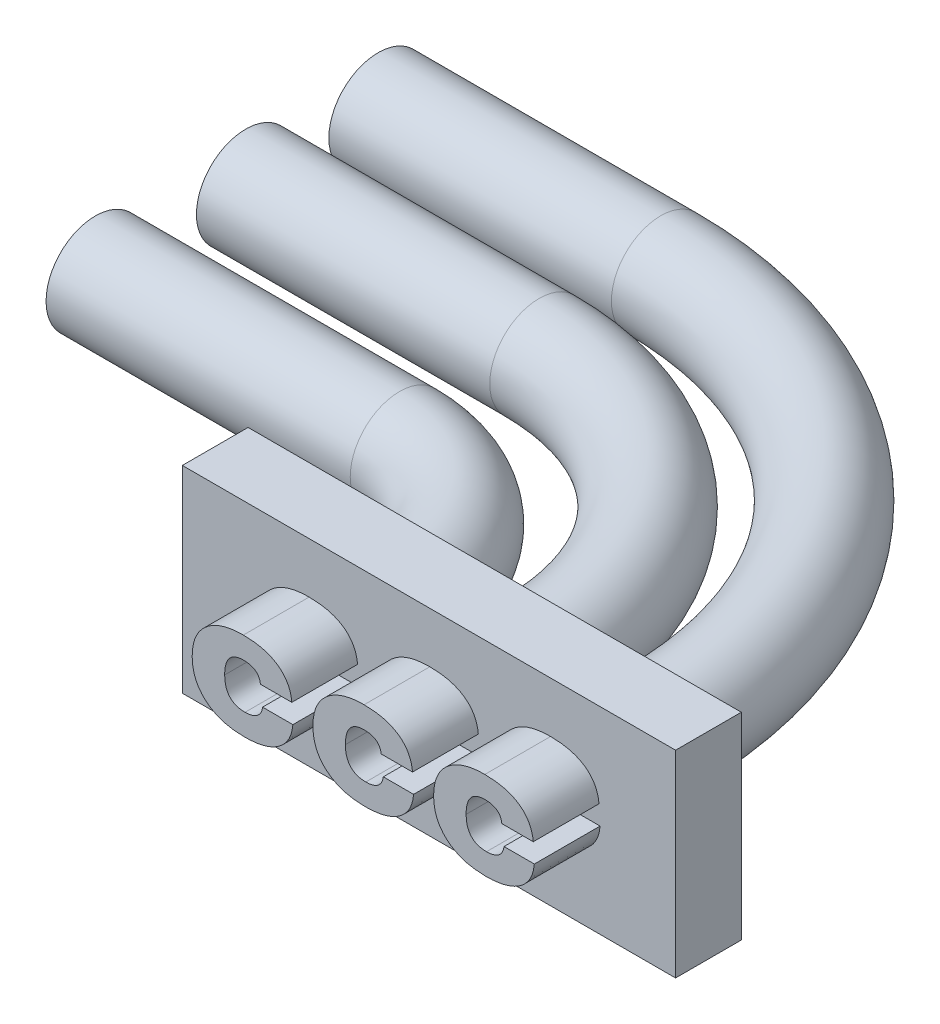
from build123d import *

# Parameters (mm, degrees)
SKETCH1_W           = 15
SKETCH1_H           = 6
BOSS_EXTRUDE1_DEPTH = 2
BOSS_EXTRUDE2_DEPTH = 2
SKETCH3_W           = 1.5
SKETCH3_H           = 4
BOSS_EXTRUDE3_DEPTH = 2
SKETCH12_W          = 14.1
SKETCH12_H          = 5
CUT_EXTRUDE1_DEPTH  = 21.804086224
SKETCH8_R           = 1.5
SKETCH7_R           = 1.5
SKETCH6_R           = 1.5


with BuildPart() as part:
    # Sketch1 → Boss-Extrude1 (new body)
    with BuildSketch(Plane.XY):
        Rectangle(SKETCH1_W, SKETCH1_H)
    extrude(amount=BOSS_EXTRUDE1_DEPTH)

    # Sketch2 → Boss-Extrude2 (add)
    with BuildSketch(Plane.XY.offset(2)):
        with BuildLine():
            Line((-3.060082731, -0.145888163), (-2.138122178, -0.145888163))
            add(Edge.make_bspline(
                [(-2.138122178, -0.145888163), (-2.142670856, -0.186817863), (-2.151591905, -0.267090827), (-2.177769169, -0.383345409), (-2.21581097, -0.492138159), (-2.263624462, -0.594453887), (-2.323094811, -0.689286262), (-2.393268208, -0.777226894), (-2.474496925, -0.857513187), (-2.56593251, -0.930702134), (-2.666921735, -0.996049335), (-2.776982197, -1.052595512), (-2.895454873, -1.100578301), (-3.022533127, -1.139544776), (-3.158112272, -1.169766838), (-3.302219404, -1.190920315), (-3.454592079, -1.204838445), (-3.559102892, -1.206109201), (-3.612641679, -1.206760184)],
                knots=[0, 0, 0, 0, 0.976829506, 1.915797078, 2.820653329, 3.707285315, 4.590388637, 5.470720937, 6.371504049, 7.295059075, 8.245589783, 9.221265507, 10.22720936, 11.275107911, 12.372107559, 13.52041678, 14.729759393, 16, 16, 16, 16], degree=3))
            add(Edge.make_bspline(
                [(-3.612641679, -1.206760184), (-3.672703037, -1.205681875), (-3.78980194, -1.203579545), (-3.960409691, -1.187028741), (-4.121131552, -1.159524222), (-4.272151379, -1.120467746), (-4.41338954, -1.070117311), (-4.545018014, -1.008999239), (-4.666052683, -0.9357143), (-4.759428604, -0.866298777), (-4.827861299, -0.80519677), (-4.876126049, -0.757629416), (-4.920907868, -0.707879294), (-4.961799812, -0.655502017), (-5.001017469, -0.602324328), (-5.03520084, -0.545835782), (-5.066531819, -0.487757573), (-5.095227297, -0.427867871), (-5.119706435, -0.365492075), (-5.141169611, -0.301230601), (-5.160246588, -0.235142926), (-5.173972983, -0.16652574), (-5.186283094, -0.096102513), (-5.194098935, -0.023574116), (-5.199662301, 0.050901618), (-5.200117214, 0.101226019), (-5.200348302, 0.126789902)],
                knots=[0, 0, 0, 0, 1.844349952, 3.595845402, 5.258382034, 6.847576437, 8.380255859, 9.857610627, 11.296535068, 12.718617156, 13.423703043, 14.112710587, 14.79899505, 15.477617194, 16.152961149, 16.826845299, 17.503194887, 18.179359879, 18.864977055, 19.559518563, 20.259847437, 20.975709944, 21.707382985, 22.454791923, 23.215062313, 24, 24, 24, 24], degree=3))
            add(Edge.make_bspline(
                [(-5.200348302, 0.126789902), (-5.20010237, 0.152180931), (-5.199614969, 0.202502272), (-5.194209089, 0.276824794), (-5.186092921, 0.349110093), (-5.174639319, 0.419303704), (-5.16060764, 0.487612395), (-5.142177766, 0.553751295), (-5.121526835, 0.618038985), (-5.096362936, 0.679989613), (-5.06892589, 0.74011142), (-5.037645758, 0.797974151), (-5.003916141, 0.854253903), (-4.966122932, 0.908133198), (-4.925686325, 0.960385835), (-4.880950125, 1.009688803), (-4.833769122, 1.057627908), (-4.766340776, 1.11879755), (-4.675008641, 1.189066666), (-4.555365546, 1.261581715), (-4.426723513, 1.323905616), (-4.288155058, 1.373282632), (-4.140527998, 1.412584115), (-3.983451282, 1.440688501), (-3.816730635, 1.457118665), (-3.702542629, 1.459248516), (-3.644025381, 1.460339989)],
                knots=[0, 0, 0, 0, 0.788949478, 1.563583616, 2.314590912, 3.048845008, 3.773225905, 4.480463959, 5.181590848, 5.870415235, 6.557195353, 7.234374924, 7.913502193, 8.595071886, 9.278472863, 9.965397725, 10.662604099, 11.368153272, 12.793402362, 14.235777976, 15.708930775, 17.227954371, 18.799982801, 20.451742852, 22.181645754, 24, 24, 24, 24], degree=3))
            add(Edge.make_bspline(
                [(-3.644025381, 1.460339989), (-3.590145407, 1.459654041), (-3.484967955, 1.458315025), (-3.331779518, 1.444898309), (-3.187282445, 1.425014513), (-3.051742807, 1.395613017), (-2.925065251, 1.357757509), (-2.807100237, 1.311399315), (-2.697988088, 1.256802381), (-2.597921972, 1.19407992), (-2.507288128, 1.123496152), (-2.42730916, 1.045048752), (-2.357479614, 0.959432927), (-2.298872924, 0.866301097), (-2.249803372, 0.766268305), (-2.212782576, 0.658660702), (-2.184664141, 0.544165897), (-2.175657871, 0.464783504), (-2.17104934, 0.42416334)],
                knots=[0, 0, 0, 0, 1.289638031, 2.517463008, 3.678757242, 4.779638757, 5.834372698, 6.840786757, 7.810284887, 8.751219913, 9.663723068, 10.555058948, 11.427779484, 12.302574037, 13.183982208, 14.089056298, 15.022165429, 16, 16, 16, 16], degree=3))
            Line((-2.17104934, 0.42416334), (-3.125937056, 0.42416334))
            add(Edge.make_bspline(
                [(-3.125937056, 0.42416334), (-3.127887549, 0.43930189), (-3.131710048, 0.468969842), (-3.142040136, 0.511730167), (-3.155998966, 0.551467781), (-3.173017188, 0.588472211), (-3.193630284, 0.622418347), (-3.217560825, 0.653683148), (-3.244880123, 0.682137249), (-3.275932903, 0.70732909), (-3.310313405, 0.72961548), (-3.347848304, 0.749134153), (-3.388701646, 0.76557697), (-3.432765481, 0.77899212), (-3.480105092, 0.789183756), (-3.530681368, 0.796119849), (-3.584421185, 0.801027394), (-3.621376024, 0.801535064), (-3.640423973, 0.801796736)],
                knots=[0, 0, 0, 0, 1.02792653, 2.014490992, 2.957386111, 3.862121815, 4.753924626, 5.627574869, 6.51019678, 7.405362218, 8.315615775, 9.266619089, 10.251558014, 11.278704828, 12.366648388, 13.51059177, 14.716862994, 16, 16, 16, 16], degree=3))
            add(Edge.make_bspline(
                [(-3.640423973, 0.801796736), (-3.66359615, 0.801322385), (-3.708533487, 0.800402487), (-3.773695909, 0.792761593), (-3.834173486, 0.779391176), (-3.890254475, 0.760839723), (-3.942034126, 0.737056913), (-3.989624331, 0.708404931), (-4.032399456, 0.67383737), (-4.070628025, 0.634091204), (-4.104105801, 0.588767942), (-4.133882485, 0.538692432), (-4.157647598, 0.482571167), (-4.177808251, 0.421494548), (-4.193663959, 0.355071069), (-4.204784234, 0.283334137), (-4.211575895, 0.206324597), (-4.212207123, 0.153214936), (-4.212533423, 0.125760928)],
                knots=[0, 0, 0, 0, 1.096253294, 2.125941888, 3.09853747, 4.02234602, 4.9155674, 5.789561441, 6.643741359, 7.510358195, 8.391630331, 9.304611926, 10.260406741, 11.268901007, 12.345516153, 13.487518248, 14.70122137, 16, 16, 16, 16], degree=3))
            add(Edge.make_bspline(
                [(-4.212533423, 0.125760928), (-4.212023732, 0.098820004), (-4.211034896, 0.046552836), (-4.20387538, -0.029304282), (-4.191745473, -0.100083864), (-4.174082766, -0.165772241), (-4.152269564, -0.226559049), (-4.125261299, -0.282308092), (-4.09338658, -0.333065066), (-4.056054059, -0.378504224), (-4.014296197, -0.419012114), (-3.96742428, -0.453622328), (-3.91626571, -0.483220184), (-3.860158566, -0.506780196), (-3.799647084, -0.525328362), (-3.73468148, -0.538434558), (-3.665177261, -0.547030055), (-3.617299342, -0.547812765), (-3.592576689, -0.548216932)],
                knots=[0, 0, 0, 0, 1.234472244, 2.394957414, 3.488022233, 4.52125041, 5.508253929, 6.443198368, 7.354559284, 8.248126489, 9.131859273, 10.013633023, 10.911406571, 11.833948595, 12.795981492, 13.807064445, 14.867636965, 16, 16, 16, 16], degree=3))
            add(Edge.make_bspline(
                [(-3.592576689, -0.548216932), (-3.573523043, -0.548008488), (-3.53637073, -0.547602048), (-3.482331036, -0.541902553), (-3.431051927, -0.534930223), (-3.383278569, -0.522562968), (-3.338007293, -0.508440572), (-3.295951089, -0.490511601), (-3.256998066, -0.469088819), (-3.220875063, -0.445176153), (-3.188314834, -0.417525473), (-3.158686185, -0.387396389), (-3.133666577, -0.353410241), (-3.111160748, -0.317572759), (-3.093383205, -0.278451413), (-3.078216775, -0.23709906), (-3.066824033, -0.192623437), (-3.06236613, -0.161718235), (-3.060082731, -0.145888163)],
                knots=[0, 0, 0, 0, 1.233312579, 2.404810797, 3.516940584, 4.580999436, 5.596108869, 6.586365755, 7.535726907, 8.472201243, 9.38661427, 10.29778373, 11.201885539, 12.11434029, 13.033597211, 13.978725792, 14.964675429, 16, 16, 16, 16], degree=3))
        make_face()
        with BuildLine():
            Line((0.611295902, -0.145888163), (1.533256455, -0.145888163))
            add(Edge.make_bspline(
                [(1.533256455, -0.145888163), (1.528707777, -0.186817863), (1.519786728, -0.267090827), (1.493609464, -0.383345409), (1.455567663, -0.492138159), (1.407754171, -0.594453887), (1.348283822, -0.689286262), (1.278110424, -0.777226894), (1.196881708, -0.857513187), (1.105446123, -0.930702134), (1.004456897, -0.996049335), (0.894396436, -1.052595512), (0.775923759, -1.100578301), (0.648845506, -1.139544776), (0.51326636, -1.169766838), (0.369159229, -1.190920315), (0.216786554, -1.204838445), (0.112275741, -1.206109201), (0.058736954, -1.206760184)],
                knots=[0, 0, 0, 0, 0.976829506, 1.915797078, 2.820653329, 3.707285315, 4.590388637, 5.470720937, 6.371504049, 7.295059075, 8.245589783, 9.221265507, 10.22720936, 11.275107911, 12.372107559, 13.52041678, 14.729759393, 16, 16, 16, 16], degree=3))
            add(Edge.make_bspline(
                [(0.058736954, -1.206760184), (-0.001324404, -1.205681875), (-0.118423307, -1.203579545), (-0.289031058, -1.187028741), (-0.449752919, -1.159524222), (-0.600772746, -1.120467746), (-0.742010907, -1.070117311), (-0.873639381, -1.008999239), (-0.99467405, -0.9357143), (-1.088049971, -0.866298777), (-1.156482666, -0.80519677), (-1.204747416, -0.757629416), (-1.249529235, -0.707879294), (-1.290421179, -0.655502017), (-1.329638836, -0.602324328), (-1.363822207, -0.545835782), (-1.395153186, -0.487757573), (-1.423848664, -0.427867871), (-1.448327802, -0.365492075), (-1.469790978, -0.301230601), (-1.488867955, -0.235142926), (-1.50259435, -0.16652574), (-1.514904461, -0.096102513), (-1.522720303, -0.023574116), (-1.528283668, 0.050901618), (-1.528738581, 0.101226019), (-1.528969669, 0.126789902)],
                knots=[0, 0, 0, 0, 1.844349952, 3.595845402, 5.258382034, 6.847576437, 8.380255859, 9.857610627, 11.296535068, 12.718617156, 13.423703043, 14.112710587, 14.79899505, 15.477617194, 16.152961149, 16.826845299, 17.503194887, 18.179359879, 18.864977055, 19.559518563, 20.259847437, 20.975709944, 21.707382985, 22.454791923, 23.215062313, 24, 24, 24, 24], degree=3))
            add(Edge.make_bspline(
                [(-1.528969669, 0.126789902), (-1.528723737, 0.152180931), (-1.528236336, 0.202502272), (-1.522830456, 0.276824794), (-1.514714289, 0.349110093), (-1.503260687, 0.419303704), (-1.489229007, 0.487612395), (-1.470799133, 0.553751295), (-1.450148202, 0.618038985), (-1.424984304, 0.679989613), (-1.397547257, 0.74011142), (-1.366267126, 0.797974151), (-1.332537508, 0.854253903), (-1.294744299, 0.908133198), (-1.254307692, 0.960385835), (-1.209571492, 1.009688803), (-1.162390489, 1.057627908), (-1.094962143, 1.11879755), (-1.003630008, 1.189066666), (-0.883986913, 1.261581715), (-0.75534488, 1.323905616), (-0.616776425, 1.373282632), (-0.469149365, 1.412584115), (-0.312072649, 1.440688501), (-0.145352002, 1.457118665), (-0.031163997, 1.459248516), (0.027353252, 1.460339989)],
                knots=[0, 0, 0, 0, 0.788949478, 1.563583616, 2.314590912, 3.048845008, 3.773225905, 4.480463959, 5.181590848, 5.870415235, 6.557195353, 7.234374924, 7.913502193, 8.595071886, 9.278472863, 9.965397725, 10.662604099, 11.368153272, 12.793402362, 14.235777976, 15.708930775, 17.227954371, 18.799982801, 20.451742852, 22.181645754, 24, 24, 24, 24], degree=3))
            add(Edge.make_bspline(
                [(0.027353252, 1.460339989), (0.081233226, 1.459654041), (0.186410678, 1.458315025), (0.339599115, 1.444898309), (0.484096188, 1.425014513), (0.619635826, 1.395613017), (0.746313382, 1.357757509), (0.864278396, 1.311399315), (0.973390545, 1.256802381), (1.073456661, 1.19407992), (1.164090505, 1.123496152), (1.244069473, 1.045048752), (1.313899019, 0.959432927), (1.372505709, 0.866301097), (1.421575261, 0.766268305), (1.458596057, 0.658660702), (1.486714492, 0.544165897), (1.495720762, 0.464783504), (1.500329293, 0.42416334)],
                knots=[0, 0, 0, 0, 1.289638031, 2.517463008, 3.678757242, 4.779638757, 5.834372698, 6.840786757, 7.810284887, 8.751219913, 9.663723068, 10.555058948, 11.427779484, 12.302574037, 13.183982208, 14.089056298, 15.022165429, 16, 16, 16, 16], degree=3))
            Line((1.500329293, 0.42416334), (0.545441576, 0.42416334))
            add(Edge.make_bspline(
                [(0.545441576, 0.42416334), (0.543491084, 0.43930189), (0.539668585, 0.468969842), (0.529338497, 0.511730167), (0.515379666, 0.551467781), (0.498361445, 0.588472211), (0.477748349, 0.622418347), (0.453817808, 0.653683148), (0.42649851, 0.682137249), (0.39544573, 0.70732909), (0.361065228, 0.72961548), (0.323530328, 0.749134153), (0.282676987, 0.76557697), (0.238613151, 0.77899212), (0.191273541, 0.789183756), (0.140697265, 0.796119849), (0.086957447, 0.801027394), (0.050002609, 0.801535064), (0.03095466, 0.801796736)],
                knots=[0, 0, 0, 0, 1.02792653, 2.014490992, 2.957386111, 3.862121815, 4.753924626, 5.627574869, 6.51019678, 7.405362218, 8.315615775, 9.266619089, 10.251558014, 11.278704828, 12.366648388, 13.51059177, 14.716862994, 16, 16, 16, 16], degree=3))
            add(Edge.make_bspline(
                [(0.03095466, 0.801796736), (0.007782483, 0.801322385), (-0.037154854, 0.800402487), (-0.102317276, 0.792761593), (-0.162794853, 0.779391176), (-0.218875842, 0.760839723), (-0.270655493, 0.737056913), (-0.318245698, 0.708404931), (-0.361020823, 0.67383737), (-0.399249392, 0.634091204), (-0.432727168, 0.588767942), (-0.462503853, 0.538692432), (-0.486268965, 0.482571167), (-0.506429618, 0.421494548), (-0.522285326, 0.355071069), (-0.533405601, 0.283334137), (-0.540197262, 0.206324597), (-0.54082849, 0.153214936), (-0.54115479, 0.125760928)],
                knots=[0, 0, 0, 0, 1.096253294, 2.125941888, 3.09853747, 4.02234602, 4.9155674, 5.789561441, 6.643741359, 7.510358195, 8.391630331, 9.304611926, 10.260406741, 11.268901007, 12.345516153, 13.487518248, 14.70122137, 16, 16, 16, 16], degree=3))
            add(Edge.make_bspline(
                [(-0.54115479, 0.125760928), (-0.540645099, 0.098820004), (-0.539656263, 0.046552836), (-0.532496747, -0.029304282), (-0.52036684, -0.100083864), (-0.502704133, -0.165772241), (-0.480890931, -0.226559049), (-0.453882667, -0.282308092), (-0.422007947, -0.333065066), (-0.384675426, -0.378504224), (-0.342917564, -0.419012114), (-0.296045647, -0.453622328), (-0.244887077, -0.483220184), (-0.188779933, -0.506780196), (-0.128268451, -0.525328362), (-0.063302847, -0.538434558), (0.006201372, -0.547030055), (0.054079291, -0.547812765), (0.078801944, -0.548216932)],
                knots=[0, 0, 0, 0, 1.234472244, 2.394957414, 3.488022233, 4.52125041, 5.508253929, 6.443198368, 7.354559284, 8.248126489, 9.131859273, 10.013633023, 10.911406571, 11.833948595, 12.795981492, 13.807064445, 14.867636965, 16, 16, 16, 16], degree=3))
            add(Edge.make_bspline(
                [(0.078801944, -0.548216932), (0.09785559, -0.548008488), (0.135007902, -0.547602048), (0.189047596, -0.541902553), (0.240326706, -0.534930223), (0.288100063, -0.522562968), (0.33337134, -0.508440572), (0.375427544, -0.490511601), (0.414380567, -0.469088819), (0.45050357, -0.445176153), (0.483063798, -0.417525473), (0.512692448, -0.387396389), (0.537712056, -0.353410241), (0.560217885, -0.317572759), (0.577995428, -0.278451413), (0.593161858, -0.23709906), (0.6045546, -0.192623437), (0.609012502, -0.161718235), (0.611295902, -0.145888163)],
                knots=[0, 0, 0, 0, 1.233312579, 2.404810797, 3.516940584, 4.580999436, 5.596108869, 6.586365755, 7.535726907, 8.472201243, 9.38661427, 10.29778373, 11.201885539, 12.11434029, 13.033597211, 13.978725792, 14.964675429, 16, 16, 16, 16], degree=3))
        make_face()
        with BuildLine():
            Line((4.282674535, -0.145888163), (5.204635088, -0.145888163))
            add(Edge.make_bspline(
                [(5.204635088, -0.145888163), (5.20008641, -0.186817863), (5.191165361, -0.267090827), (5.164988097, -0.383345409), (5.126946296, -0.492138159), (5.079132804, -0.594453887), (5.019662455, -0.689286262), (4.949489057, -0.777226894), (4.868260341, -0.857513187), (4.776824756, -0.930702134), (4.67583553, -0.996049335), (4.565775069, -1.052595512), (4.447302392, -1.100578301), (4.320224139, -1.139544776), (4.184644993, -1.169766838), (4.040537862, -1.190920315), (3.888165187, -1.204838445), (3.783654374, -1.206109201), (3.730115587, -1.206760184)],
                knots=[0, 0, 0, 0, 0.976829506, 1.915797078, 2.820653329, 3.707285315, 4.590388637, 5.470720937, 6.371504049, 7.295059075, 8.245589783, 9.221265507, 10.22720936, 11.275107911, 12.372107559, 13.52041678, 14.729759393, 16, 16, 16, 16], degree=3))
            add(Edge.make_bspline(
                [(3.730115587, -1.206760184), (3.670054229, -1.205681875), (3.552955326, -1.203579545), (3.382347575, -1.187028741), (3.221625714, -1.159524222), (3.070605887, -1.120467746), (2.929367726, -1.070117311), (2.797739252, -1.008999239), (2.676704583, -0.9357143), (2.583328662, -0.866298777), (2.514895967, -0.80519677), (2.466631217, -0.757629416), (2.421849398, -0.707879294), (2.380957454, -0.655502017), (2.341739797, -0.602324328), (2.307556425, -0.545835782), (2.276225447, -0.487757573), (2.247529968, -0.427867871), (2.223050831, -0.365492075), (2.201587655, -0.301230601), (2.182510678, -0.235142926), (2.168784283, -0.16652574), (2.156474172, -0.096102513), (2.14865833, -0.023574116), (2.143094965, 0.050901618), (2.142640052, 0.101226019), (2.142408964, 0.126789902)],
                knots=[0, 0, 0, 0, 1.844349952, 3.595845402, 5.258382034, 6.847576437, 8.380255859, 9.857610627, 11.296535068, 12.718617156, 13.423703043, 14.112710587, 14.79899505, 15.477617194, 16.152961149, 16.826845299, 17.503194887, 18.179359879, 18.864977055, 19.559518563, 20.259847437, 20.975709944, 21.707382985, 22.454791923, 23.215062313, 24, 24, 24, 24], degree=3))
            add(Edge.make_bspline(
                [(2.142408964, 0.126789902), (2.142654896, 0.152180931), (2.143142297, 0.202502272), (2.148548177, 0.276824794), (2.156664344, 0.349110093), (2.168117946, 0.419303704), (2.182149625, 0.487612395), (2.2005795, 0.553751295), (2.221230431, 0.618038985), (2.246394329, 0.679989613), (2.273831375, 0.74011142), (2.305111507, 0.797974151), (2.338841125, 0.854253903), (2.376634334, 0.908133198), (2.417070941, 0.960385835), (2.461807141, 1.009688803), (2.508988144, 1.057627908), (2.57641649, 1.11879755), (2.667748625, 1.189066666), (2.78739172, 1.261581715), (2.916033753, 1.323905616), (3.054602208, 1.373282632), (3.202229268, 1.412584115), (3.359305984, 1.440688501), (3.52602663, 1.457118665), (3.640214636, 1.459248516), (3.698731885, 1.460339989)],
                knots=[0, 0, 0, 0, 0.788949478, 1.563583616, 2.314590912, 3.048845008, 3.773225905, 4.480463959, 5.181590848, 5.870415235, 6.557195353, 7.234374924, 7.913502193, 8.595071886, 9.278472863, 9.965397725, 10.662604099, 11.368153272, 12.793402362, 14.235777976, 15.708930775, 17.227954371, 18.799982801, 20.451742852, 22.181645754, 24, 24, 24, 24], degree=3))
            add(Edge.make_bspline(
                [(3.698731885, 1.460339989), (3.752611859, 1.459654041), (3.857789311, 1.458315025), (4.010977748, 1.444898309), (4.155474821, 1.425014513), (4.291014459, 1.395613017), (4.417692015, 1.357757509), (4.535657029, 1.311399315), (4.644769178, 1.256802381), (4.744835294, 1.19407992), (4.835469138, 1.123496152), (4.915448106, 1.045048752), (4.985277651, 0.959432927), (5.043884342, 0.866301097), (5.092953894, 0.766268305), (5.12997469, 0.658660702), (5.158093125, 0.544165897), (5.167099395, 0.464783504), (5.171707925, 0.42416334)],
                knots=[0, 0, 0, 0, 1.289638031, 2.517463008, 3.678757242, 4.779638757, 5.834372698, 6.840786757, 7.810284887, 8.751219913, 9.663723068, 10.555058948, 11.427779484, 12.302574037, 13.183982208, 14.089056298, 15.022165429, 16, 16, 16, 16], degree=3))
            Line((5.171707925, 0.42416334), (4.216820209, 0.42416334))
            add(Edge.make_bspline(
                [(4.216820209, 0.42416334), (4.214869717, 0.43930189), (4.211047218, 0.468969842), (4.20071713, 0.511730167), (4.186758299, 0.551467781), (4.169740078, 0.588472211), (4.149126982, 0.622418347), (4.125196441, 0.653683148), (4.097877142, 0.682137249), (4.066824363, 0.70732909), (4.032443861, 0.72961548), (3.994908961, 0.749134153), (3.95405562, 0.76557697), (3.909991784, 0.77899212), (3.862652174, 0.789183756), (3.812075898, 0.796119849), (3.75833608, 0.801027394), (3.721381242, 0.801535064), (3.702333293, 0.801796736)],
                knots=[0, 0, 0, 0, 1.02792653, 2.014490992, 2.957386111, 3.862121815, 4.753924626, 5.627574869, 6.51019678, 7.405362218, 8.315615775, 9.266619089, 10.251558014, 11.278704828, 12.366648388, 13.51059177, 14.716862994, 16, 16, 16, 16], degree=3))
            add(Edge.make_bspline(
                [(3.702333293, 0.801796736), (3.679161115, 0.801322385), (3.634223779, 0.800402487), (3.569061357, 0.792761593), (3.50858378, 0.779391176), (3.452502791, 0.760839723), (3.400723139, 0.737056913), (3.353132935, 0.708404931), (3.31035781, 0.67383737), (3.272129241, 0.634091204), (3.238651465, 0.588767942), (3.20887478, 0.538692432), (3.185109668, 0.482571167), (3.164949015, 0.421494548), (3.149093307, 0.355071069), (3.137973032, 0.283334137), (3.13118137, 0.206324597), (3.130550143, 0.153214936), (3.130223843, 0.125760928)],
                knots=[0, 0, 0, 0, 1.096253294, 2.125941888, 3.09853747, 4.02234602, 4.9155674, 5.789561441, 6.643741359, 7.510358195, 8.391630331, 9.304611926, 10.260406741, 11.268901007, 12.345516153, 13.487518248, 14.70122137, 16, 16, 16, 16], degree=3))
            add(Edge.make_bspline(
                [(3.130223843, 0.125760928), (3.130733534, 0.098820004), (3.131722369, 0.046552836), (3.138881885, -0.029304282), (3.151011793, -0.100083864), (3.1686745, -0.165772241), (3.190487702, -0.226559049), (3.217495966, -0.282308092), (3.249370686, -0.333065066), (3.286703207, -0.378504224), (3.328461069, -0.419012114), (3.375332985, -0.453622328), (3.426491556, -0.483220184), (3.4825987, -0.506780196), (3.543110182, -0.525328362), (3.608075786, -0.538434558), (3.677580005, -0.547030055), (3.725457923, -0.547812765), (3.750180576, -0.548216932)],
                knots=[0, 0, 0, 0, 1.234472244, 2.394957414, 3.488022233, 4.52125041, 5.508253929, 6.443198368, 7.354559284, 8.248126489, 9.131859273, 10.013633023, 10.911406571, 11.833948595, 12.795981492, 13.807064445, 14.867636965, 16, 16, 16, 16], degree=3))
            add(Edge.make_bspline(
                [(3.750180576, -0.548216932), (3.769234223, -0.548008488), (3.806386535, -0.547602048), (3.860426229, -0.541902553), (3.911705338, -0.534930223), (3.959478696, -0.522562968), (4.004749973, -0.508440572), (4.046806177, -0.490511601), (4.0857592, -0.469088819), (4.121882203, -0.445176153), (4.154442431, -0.417525473), (4.184071081, -0.387396389), (4.209090689, -0.353410241), (4.231596518, -0.317572759), (4.249374061, -0.278451413), (4.264540491, -0.23709906), (4.275933233, -0.192623437), (4.280391135, -0.161718235), (4.282674535, -0.145888163)],
                knots=[0, 0, 0, 0, 1.233312579, 2.404810797, 3.516940584, 4.580999436, 5.596108869, 6.586365755, 7.535726907, 8.472201243, 9.38661427, 10.29778373, 11.201885539, 12.11434029, 13.033597211, 13.978725792, 14.964675429, 16, 16, 16, 16], degree=3))
        make_face()
    extrude(amount=BOSS_EXTRUDE2_DEPTH)

    # Sketch3 → Boss-Extrude3 (add, symmetric)
    with BuildSketch(Plane(origin=(0, 0, 0), x_dir=(1, 0, 0), z_dir=(0, 1, 0))):
        Polygon((2.948731885, 0), (4.448731885, 0), (4.448731885, 14.1), (-2.422646748, 14.1), (-2.422646748, 12.6), (2.948731885, 12.6), align=None)
        with Locations((-3.644025381, 2)):
            Rectangle(SKETCH3_W, SKETCH3_H)
        Polygon((-0.722646748, 0), (0.777353252, 0), (0.777353252, 10.1), (-2.422646748, 10.1), (-2.422646748, 8.6), (-0.722646748, 8.6), align=None)
    extrude(amount=BOSS_EXTRUDE3_DEPTH, both=True)

    # Sketch12 → Cut-Extrude1 (cut, through all)
    with BuildSketch(Plane(origin=(7.5, 0, 0), x_dir=(0, 0, -1), z_dir=(1, 0, 0))):
        with Locations((7.05, -0.5)):
            Rectangle(SKETCH12_W, SKETCH12_H)
    extrude(amount=-CUT_EXTRUDE1_DEPTH, mode=Mode.SUBTRACT)

    # Sweep1: sweep along a path in Sketch9
    with BuildLine(Plane(origin=(0, 0, 0), x_dir=(1, 0, 0), z_dir=(0, 1, 0))) as sweep1_path:
        Line((-3.644025381, 0), (-3.644025381, 0.75))
        ThreePointArc((-3.644025381, 0.75), (-4.815598256, 3.578427125), (-7.644025381, 4.75))
        Line((-7.644025381, 4.75), (-16.894025381, 4.75))
    # Sketch8 → Sweep1 (sweep)
    with BuildSketch(Plane(origin=(0, 0, 0), x_dir=(-1, 0, 0), z_dir=(0, 0, -1))):
        with Locations((3.644025381, 0)):
            Circle(SKETCH8_R)
    sweep(path=sweep1_path.line)

    # Sweep2: sweep along a path in Sketch10
    with BuildLine(Plane(origin=(0, 0, 0), x_dir=(1, 0, 0), z_dir=(0, 1, 0))) as sweep2_path:
        Line((0.027353252, 0), (0.027353252, 1.35))
        ThreePointArc((0.027353252, 1.35), (-2.315792499, 7.006854249), (-7.972646748, 9.35))
        Line((-7.972646748, 9.35), (-16.894025748, 9.35))
    # Sketch7 → Sweep2 (sweep)
    with BuildSketch(Plane(origin=(0, 0, 0), x_dir=(-1, 0, 0), z_dir=(0, 0, -1))):
        Circle(SKETCH7_R)
    sweep(path=sweep2_path.line)

    # Sweep3: sweep along a path in Sketch11
    with BuildLine(Plane(origin=(0, 0, 0), x_dir=(1, 0, 0), z_dir=(0, 1, 0))) as sweep3_path:
        Line((3.698731885, 0), (3.698731885, 1.35))
        ThreePointArc((3.698731885, 1.35), (0.184013259, 9.835281374), (-8.301268115, 13.35))
        Line((-8.301268115, 13.35), (-16.894025115, 13.35))
    # Sketch6 → Sweep3 (sweep)
    with BuildSketch(Plane(origin=(0, 0, 0), x_dir=(-1, 0, 0), z_dir=(0, 0, -1))):
        with Locations((-3.698731885, 0)):
            Circle(SKETCH6_R)
    sweep(path=sweep3_path.line)


solid = part.part
